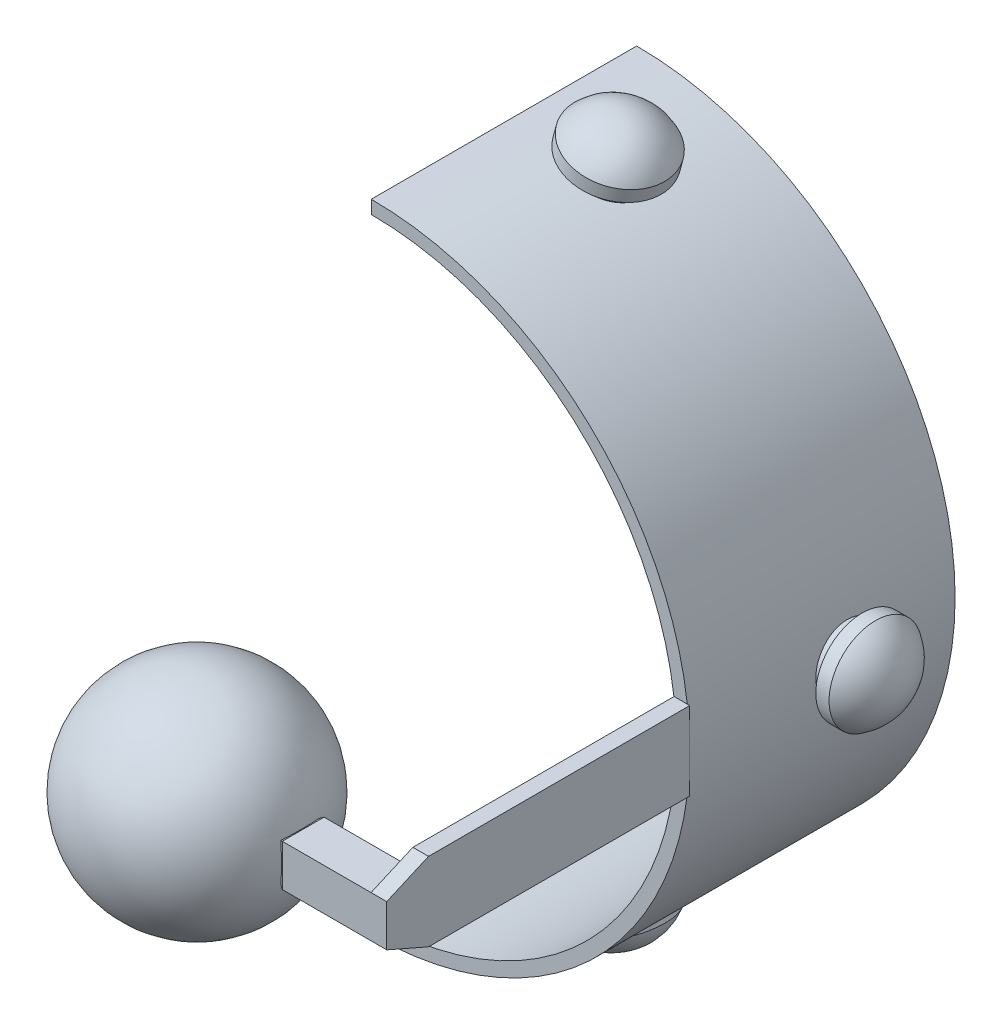
from build123d import *

# Parameters (mm, degrees)
SKETCH1_W                                    = 16
SKETCH1_H                                    = 16
BOSS_EXTRUDE1_DEPTH                          = 20
SKETCH5_W                                    = 16
SKETCH5_H                                    = 16
SKETCH5_W_2                                  = 8
SKETCH5_H_2                                  = 8
CUT_EXTRUDE2_DEPTH                           = 20
SKETCH6_W                                    = 3
SKETCH6_H                                    = 15
BOSS_EXTRUDE2_DEPTH                          = 50
BOSS_EXTRUDE3_DEPTH                          = 3
SKETCH8_W                                    = 8
SKETCH8_H                                    = 8
BOSS_EXTRUDE5_DEPTH                          = 3
BOSS_EXTRUDE5_TAPER                          = 30
BOSS_EXTRUDE7_DEPTH                          = 50.8
BOSS_EXTRUDE8_START                          = -1.27
SKETCH12_R                                   = 6.35
BOSS_EXTRUDE8_DEPTH                          = 3.81
SKETCH13_R                                   = 8.89
BOSS_EXTRUDE9_DEPTH                          = 2.54
DOME2_FACE_RADIUS                            = 8.89
DOME2_HEIGHT                                 = 5.08
CIRPATTERN1_COUNT                            = 2
CIRPATTERN1_ANGLE                            = 75
CIRPATTERN1_COPY_1_FACE_RADIUS               = 8.89
CIRPATTERN1_COPY_1_HEIGHT                    = 5.08
CIRPATTERN1_THE_OTHER_WAY_COUNT              = 2
CIRPATTERN1_THE_OTHER_WAY_ANGLE              = 75
CIRPATTERN1_THE_OTHER_WAY_COPY_1_FACE_RADIUS = 8.89
CIRPATTERN1_THE_OTHER_WAY_COPY_1_HEIGHT      = 5.08


with BuildPart() as part:
    # Sketch1 → Boss-Extrude1 (new body)
    with BuildSketch(Plane(origin=(0, 0, 0), x_dir=(0, 0, -1), z_dir=(1, 0, 0))):
        Rectangle(SKETCH1_W, SKETCH1_H)
    extrude(amount=BOSS_EXTRUDE1_DEPTH)

    # Sketch5 → Cut-Extrude2 (cut)
    with BuildSketch(Plane.ZY):
        Rectangle(SKETCH5_W, SKETCH5_H)
        Rectangle(SKETCH5_W_2, SKETCH5_H_2, mode=Mode.SUBTRACT)
    extrude(amount=-CUT_EXTRUDE2_DEPTH, mode=Mode.SUBTRACT)

    # Sketch6 → Boss-Extrude2 (add)
    with BuildSketch(Plane(origin=(0, 0, -4), x_dir=(-1, 0, 0), z_dir=(0, 0, -1))):
        with Locations((-18.5, 0)):
            Rectangle(SKETCH6_W, SKETCH6_H)
    extrude(amount=BOSS_EXTRUDE2_DEPTH)

    # Sketch7 → Boss-Extrude3 (add)
    with BuildSketch(Plane(origin=(20, 0, 0), x_dir=(0, 0, -1), z_dir=(1, 0, 0))):
        Polygon((4, 7.5), (-4, 4), (4, 4), align=None)
        Polygon((4, -4), (4, -7.5), (-4, -4), align=None)
    extrude(amount=-BOSS_EXTRUDE3_DEPTH)



with BuildPart() as body_2:
    # Sketch4 → Revolve2 (revolve)
    with BuildSketch(Plane.XY):
        with BuildLine():
            Line((-20.32, 20.32), (-20.32, -20.32))
            ThreePointArc((-20.32, -20.32), (0, 0), (-20.32, 20.32))
        make_face()
    revolve(axis=Axis((-20.32, 20.32, 0), (0, -1, 0)))


with BuildPart() as part_1:
    add(part.part)

    add(body_2.part)  # Boss-Extrude5 merges body 2
    # Sketch8 → Boss-Extrude5 (add)
    with BuildSketch(Plane.ZY):
        Rectangle(SKETCH8_W, SKETCH8_H)
    extrude(amount=BOSS_EXTRUDE5_DEPTH, taper=BOSS_EXTRUDE5_TAPER)

    # Sketch11 → Boss-Extrude7 (add)
    with BuildSketch(Plane(origin=(0, 0, -54), x_dir=(-1, 0, 0), z_dir=(0, 0, -1))):
        with BuildLine():
            Line((40.96, 60.96), (40.96, 58.42))
            ThreePointArc((40.96, 58.42), (-17.46, 0), (40.96, -58.42))
            Line((40.96, -58.42), (40.96, -60.96))
            ThreePointArc((40.96, -60.96), (-20, 0), (40.96, 60.96))
        make_face()
    extrude(amount=BOSS_EXTRUDE7_DEPTH)

    # Sketch12 → Boss-Extrude8 (add)
    with BuildSketch(Plane(origin=(20, 0, 0), x_dir=(0, 0, -1), z_dir=(1, 0, 0)).offset(BOSS_EXTRUDE8_START)):
        with Locations((84.48, 0)):
            Circle(SKETCH12_R)
    boss_extrude8 = extrude(amount=BOSS_EXTRUDE8_DEPTH)

    # Sketch13 → Boss-Extrude9 (add)
    with BuildSketch(Plane(origin=(22.54, 0, 0), x_dir=(0, 0, -1), z_dir=(1, 0, 0))):
        with Locations((84.48, 0)):
            Circle(SKETCH13_R)
    boss_extrude9 = extrude(amount=BOSS_EXTRUDE9_DEPTH)

    # Dome2: a dome of height H over a round flat face of radius A is a cap of a sphere of radius (A * A + H * H) / (2 * H)
    dome2_r = (DOME2_FACE_RADIUS * DOME2_FACE_RADIUS + DOME2_HEIGHT * DOME2_HEIGHT) / (2 * DOME2_HEIGHT)
    dome2_base = Plane((25.08, 0, -84.48), z_dir=(1, 0, 0))
    with Locations(dome2_base.offset(DOME2_HEIGHT - dome2_r)):
        dome2_ball = Sphere(dome2_r, mode=Mode.PRIVATE)
    add(split(dome2_ball, bisect_by=dome2_base, keep=Keep.TOP, mode=Mode.PRIVATE))

    # CirPattern1: Boss-Extrude8, Boss-Extrude9 ×2 about axis
    cirpattern1_axis = Axis((-40.96, 0, 0), (0, 0, -1))
    add([boss_extrude8.rotate(cirpattern1_axis, i * CIRPATTERN1_ANGLE / (CIRPATTERN1_COUNT - 1)) for i in range(1, CIRPATTERN1_COUNT)])
    add([boss_extrude9.rotate(cirpattern1_axis, i * CIRPATTERN1_ANGLE / (CIRPATTERN1_COUNT - 1)) for i in range(1, CIRPATTERN1_COUNT)])

    # CirPattern1 copy 1: a dome of height H over a round flat face of radius A is a cap of a sphere of radius (A * A + H * H) / (2 * H)
    cirpattern1_copy_1_r = (CIRPATTERN1_COPY_1_FACE_RADIUS * CIRPATTERN1_COPY_1_FACE_RADIUS + CIRPATTERN1_COPY_1_HEIGHT * CIRPATTERN1_COPY_1_HEIGHT) / (2 * CIRPATTERN1_COPY_1_HEIGHT)
    cirpattern1_copy_1_base = Plane((-23.867590261, -63.789741568, -84.48), z_dir=(0.258819045103, -0.965925826289, 0))
    with Locations(cirpattern1_copy_1_base.offset(CIRPATTERN1_COPY_1_HEIGHT - cirpattern1_copy_1_r)):
        cirpattern1_copy_1_ball = Sphere(cirpattern1_copy_1_r, mode=Mode.PRIVATE)
    add(split(cirpattern1_copy_1_ball, bisect_by=cirpattern1_copy_1_base, keep=Keep.TOP, mode=Mode.PRIVATE))

    # CirPattern1 the other way: Boss-Extrude8, Boss-Extrude9 ×2 about axis
    cirpattern1_the_other_way_axis = Axis((-40.96, 0, 0), (0, 0, 1))
    add([boss_extrude8.rotate(cirpattern1_the_other_way_axis, i * CIRPATTERN1_THE_OTHER_WAY_ANGLE / (CIRPATTERN1_THE_OTHER_WAY_COUNT - 1)) for i in range(1, CIRPATTERN1_THE_OTHER_WAY_COUNT)])
    add([boss_extrude9.rotate(cirpattern1_the_other_way_axis, i * CIRPATTERN1_THE_OTHER_WAY_ANGLE / (CIRPATTERN1_THE_OTHER_WAY_COUNT - 1)) for i in range(1, CIRPATTERN1_THE_OTHER_WAY_COUNT)])

    # CirPattern1 the other way copy 1: a dome of height H over a round flat face of radius A is a cap of a sphere of radius (A * A + H * H) / (2 * H)
    cirpattern1_the_other_way_copy_1_r = (CIRPATTERN1_THE_OTHER_WAY_COPY_1_FACE_RADIUS * CIRPATTERN1_THE_OTHER_WAY_COPY_1_FACE_RADIUS + CIRPATTERN1_THE_OTHER_WAY_COPY_1_HEIGHT * CIRPATTERN1_THE_OTHER_WAY_COPY_1_HEIGHT) / (2 * CIRPATTERN1_THE_OTHER_WAY_COPY_1_HEIGHT)
    cirpattern1_the_other_way_copy_1_base = Plane((-23.867590261, 63.789741568, -84.48), z_dir=(0.258819045103, 0.965925826289, 0))
    with Locations(cirpattern1_the_other_way_copy_1_base.offset(CIRPATTERN1_THE_OTHER_WAY_COPY_1_HEIGHT - cirpattern1_the_other_way_copy_1_r)):
        cirpattern1_the_other_way_copy_1_ball = Sphere(cirpattern1_the_other_way_copy_1_r, mode=Mode.PRIVATE)
    add(split(cirpattern1_the_other_way_copy_1_ball, bisect_by=cirpattern1_the_other_way_copy_1_base, keep=Keep.TOP, mode=Mode.PRIVATE))


solid = part_1.part
